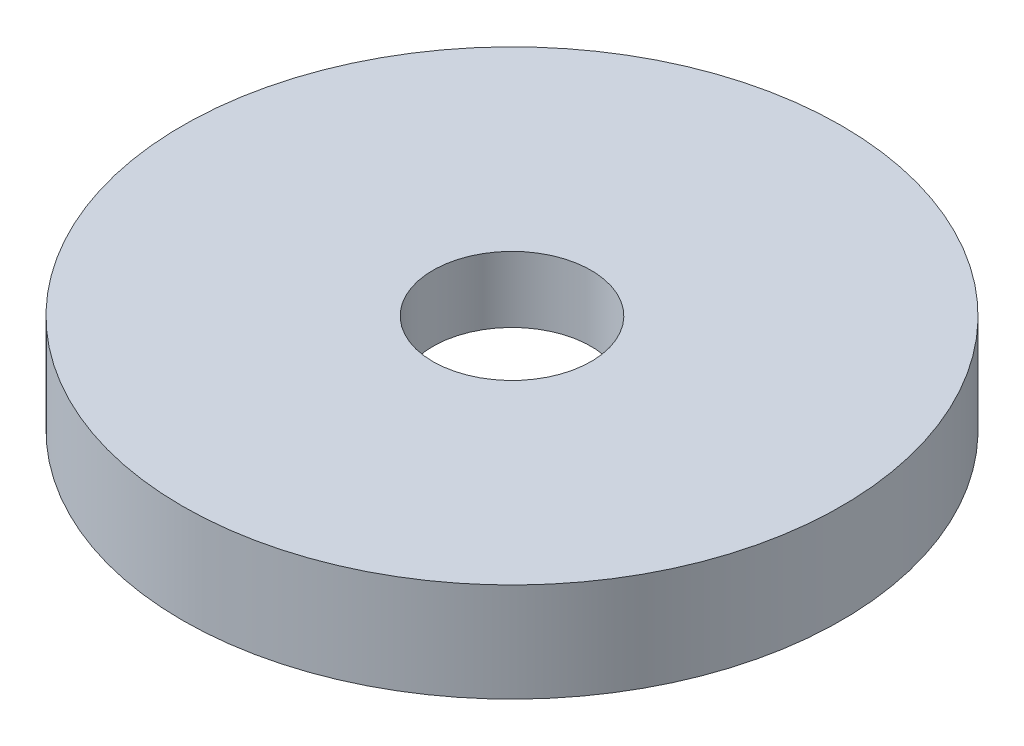
from build123d import *

# Parameters (mm, degrees)
SKETCH1_R           = 5
SKETCH1_R_2         = 1.2
BOSS_EXTRUDE1_DEPTH = 1.5
SKETCH1_3_R         = 2.5
SKETCH1_3_R_2       = 1.2
CUT_EXTRUDE1_DEPTH  = 0.5


with BuildPart() as part:
    # Sketch1 → Boss-Extrude1 (new body)
    with BuildSketch(Plane(origin=(0, 0, 0), x_dir=(1, 0, 0), z_dir=(0, 1, 0))):
        Circle(SKETCH1_R)
        Circle(SKETCH1_R_2, mode=Mode.SUBTRACT)
    extrude(amount=BOSS_EXTRUDE1_DEPTH)

    # Sketch1<3> → Cut-Extrude1 (cut)
    with BuildSketch(Plane(origin=(0, 0, 0), x_dir=(1, 0, 0), z_dir=(0, 1, 0))):
        Circle(SKETCH1_3_R)
        Circle(SKETCH1_3_R_2, mode=Mode.SUBTRACT)
    extrude(amount=CUT_EXTRUDE1_DEPTH, mode=Mode.SUBTRACT)


solid = part.part
